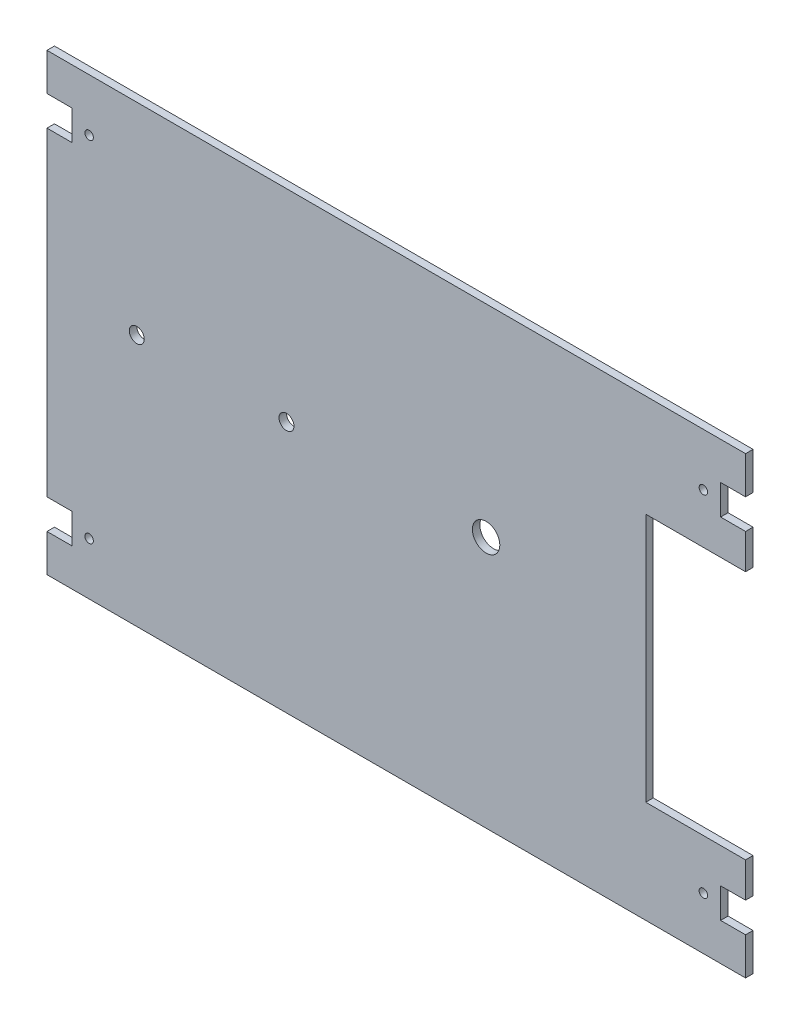
from build123d import *

# Parameters (mm, degrees)
BOSS_EXTRUDE1_DEPTH = 1.5
SKETCH2_R           = 1.5
SKETCH2_R_2         = 2.75
CUT_EXTRUDE1_DEPTH  = 1.5
SKETCH5_W           = 5
SKETCH5_H           = 6
SKETCH5_R           = 0.85
CUT_EXTRUDE5_DEPTH  = 167.982783544


with BuildPart() as part:
    # Sketch1 → Boss-Extrude1 (new body)
    with BuildSketch(Plane.XY):
        Polygon((140, 0), (0, 0), (0, -91), (140, -91), (140, -70.5), (120, -70.5), (120, -20.5), (140, -20.5), align=None)
    extrude(amount=BOSS_EXTRUDE1_DEPTH)

    # Sketch2 → Cut-Extrude1 (cut)
    with BuildSketch(Plane.XY.offset(1.5)):
        with Locations((18, -40.4)):
            Circle(SKETCH2_R)
        with Locations((48, -40.5)):
            Circle(SKETCH2_R)
        with Locations((88, -40.5)):
            Circle(SKETCH2_R_2)
    extrude(amount=-CUT_EXTRUDE1_DEPTH, mode=Mode.SUBTRACT)

    # Sketch5 → Cut-Extrude5 (cut, through all)
    with BuildSketch(Plane.XY.offset(1.5)):
        with Locations((2.5, -10.5)):
            Rectangle(SKETCH5_W, SKETCH5_H)
        with Locations((2.5, -80.5)):
            Rectangle(SKETCH5_W, SKETCH5_H)
        with Locations((137.5, -80.5)):
            Rectangle(SKETCH5_W, SKETCH5_H)
        with Locations((137.5, -10.5)):
            Rectangle(SKETCH5_W, SKETCH5_H)
        with Locations((8.45, -10.5)):
            Circle(SKETCH5_R)
        with Locations((8.45, -80.5)):
            Circle(SKETCH5_R)
        with Locations((131.55, -80.5)):
            Circle(SKETCH5_R)
        with Locations((131.55, -10.5)):
            Circle(SKETCH5_R)
    extrude(amount=-CUT_EXTRUDE5_DEPTH, mode=Mode.SUBTRACT)


solid = part.part
